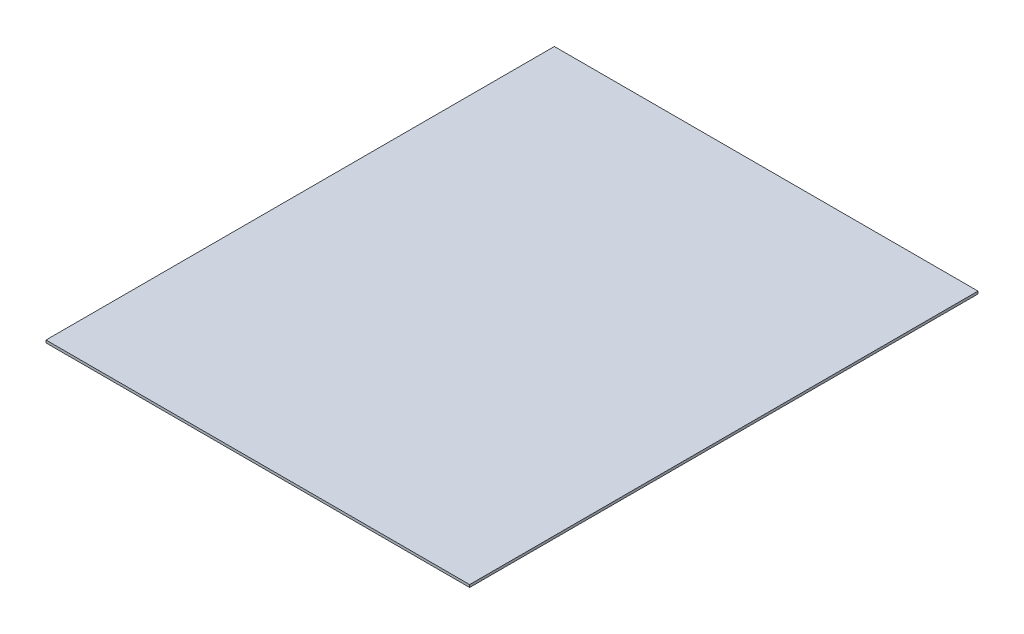
from build123d import *

# Parameters (mm, degrees)
SKETCH2_W           = 500
SKETCH2_H           = 600
BOSS_EXTRUDE1_DEPTH = 3


with BuildPart() as part:
    # Sketch2 → Boss-Extrude1 (new body)
    with BuildSketch(Plane(origin=(0, 0, 0), x_dir=(1, 0, 0), z_dir=(0, 1, 0))):
        with Locations((229.666666667, -284.416666667)):
            Rectangle(SKETCH2_W, SKETCH2_H)
    extrude(amount=BOSS_EXTRUDE1_DEPTH)


solid = part.part
